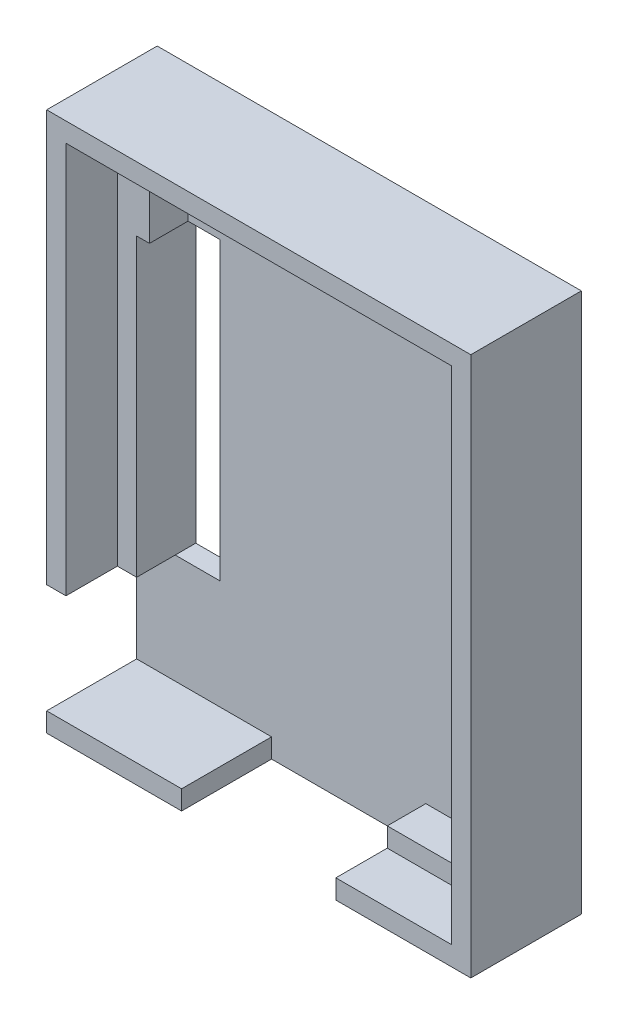
from build123d import *

# Parameters (mm, degrees)
ESBO_O1_W                = 33
ESBO_O1_H                = 42
ESBO_O1_W_2              = 3.5
ESBO_O1_H_2              = 23
RESSALTO_EXTRUS_O5_DEPTH = 1.6
ESBO_O1_4_W              = 10.5
ESBO_O1_4_H              = 1.5
RESSALTO_EXTRUS_O6_DEPTH = 7
RESSALTO_EXTRUS_O7_DEPTH = 3


with BuildPart() as part:
    # Esboço1 → Ressalto-extrusão5 (new body)
    with BuildSketch(Plane.XY):
        with Locations((0, 7)):
            Rectangle(ESBO_O1_W, ESBO_O1_H)
        with Locations((11.75, 7.5)):
            Rectangle(ESBO_O1_W_2, ESBO_O1_H_2, mode=Mode.SUBTRACT)
        with Locations((-11.75, 7.5)):
            Rectangle(ESBO_O1_W_2, ESBO_O1_H_2, mode=Mode.SUBTRACT)
    extrude(amount=-RESSALTO_EXTRUS_O5_DEPTH)

    # Esboço1<4> → Ressalto-extrusão6 (add)
    with BuildSketch(Plane.XY):
        Polygon((-16.5, -4), (-15, -4), (-15, 26.5), (15, 26.5), (15, -12.5), (6, -12.5), (6, -14), (16.5, -14), (16.5, 28), (-16.5, 28), align=None)
        with Locations((-11.25, -13.25)):
            Rectangle(ESBO_O1_4_W, ESBO_O1_4_H)
    extrude(amount=RESSALTO_EXTRUS_O6_DEPTH)

    # Esboço1<5> → Ressalto-extrusão7 (add)
    with BuildSketch(Plane.XY):
        Polygon((12.5, 24), (12.5, 19), (13.5, 19), (13.5, -11), (6, -11), (6, -12.5), (15, -12.5), (15, 26.5), (-15, 26.5), (-15, -4), (-13.5, -4), (-13.5, 19), (-12.5, 19), (-12.5, 24), align=None)
    extrude(amount=RESSALTO_EXTRUS_O7_DEPTH)


solid = part.part
